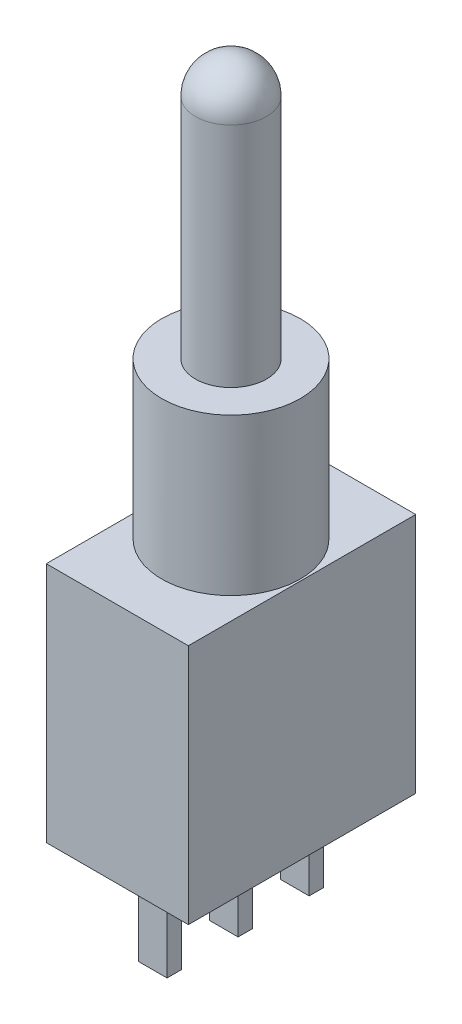
from build123d import *

# Parameters (mm, degrees)
SKETCH1_W           = 5.08
SKETCH1_H           = 8.128
BOSS_EXTRUDE1_DEPTH = 8.636
SKETCH2_R           = 2.4765
BOSS_EXTRUDE2_DEPTH = 5.588
SKETCH3_W           = 1.016
SKETCH3_H           = 0.508
BOSS_EXTRUDE3_DEPTH = 3.302
SKETCH4_R           = 1.27
BOSS_EXTRUDE4_DEPTH = 9.398
FILLET1_R           = 1.27


with BuildPart() as part:
    # Sketch1 → Boss-Extrude1 (new body)
    with BuildSketch(Plane(origin=(0, 0, 0), x_dir=(1, 0, 0), z_dir=(0, 1, 0))):
        Rectangle(SKETCH1_W, SKETCH1_H)
    extrude(amount=BOSS_EXTRUDE1_DEPTH)

    # Sketch2 → Boss-Extrude2 (add)
    with BuildSketch(Plane(origin=(0, 8.636, 0), x_dir=(1, 0, 0), z_dir=(0, 1, 0))):
        with Locations(Location((0, 0, 0), (0, 0, 90))):
            Circle(SKETCH2_R)
    extrude(amount=BOSS_EXTRUDE2_DEPTH)

    # Sketch3 → Boss-Extrude3 (add)
    with BuildSketch(Plane.XZ):
        Rectangle(SKETCH3_W, SKETCH3_H)
        with Locations((0, -2.54)):
            Rectangle(SKETCH3_W, SKETCH3_H)
        with Locations((0, 2.54)):
            Rectangle(SKETCH3_W, SKETCH3_H)
    extrude(amount=BOSS_EXTRUDE3_DEPTH)

    # Sketch4 → Boss-Extrude4 (add)
    with BuildSketch(Plane(origin=(0, 14.224, 0), x_dir=(1, 0, 0), z_dir=(0, 1, 0))):
        with Locations(Location((0, 0, 0), (0, 0, 270))):
            Circle(SKETCH4_R)
    extrude(amount=BOSS_EXTRUDE4_DEPTH)

    # Fillet1
    fillet1_edges = [part.edges().sort_by_distance(p)[0] for p in [
        (0, 23.622, -1.27),
    ]]
    fillet(fillet1_edges, radius=FILLET1_R)


solid = part.part
